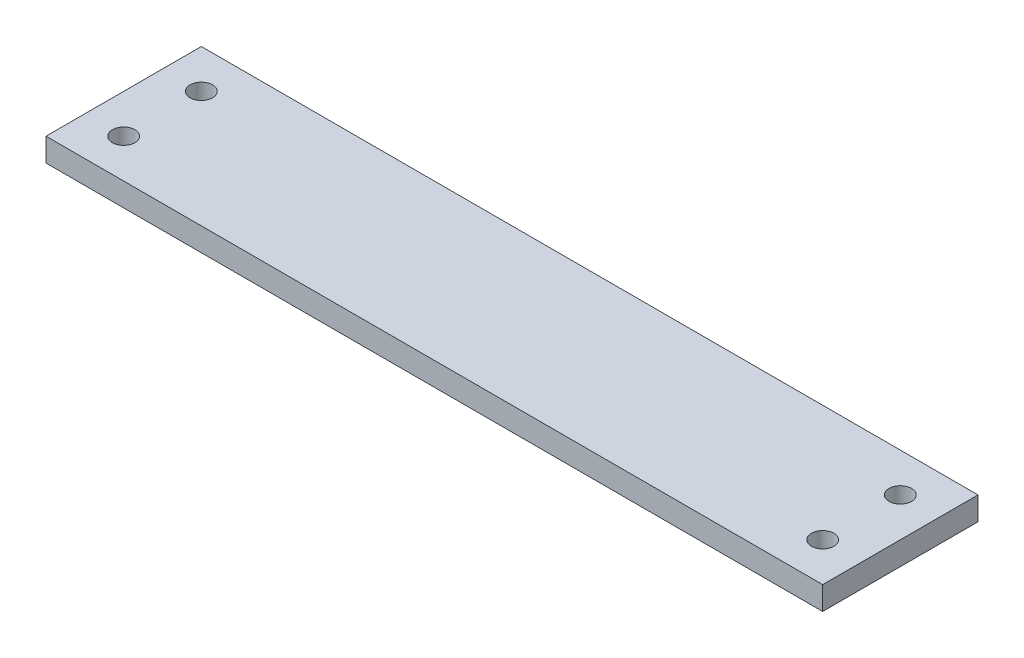
from build123d import *

# Parameters (mm, degrees)
SKETCH_1_W          = 100
SKETCH_1_H          = 20
EXTRUDE_1_DEPTH     = 3
SKETCH_2_R          = 1.45
CUT_EXTRUDE_1_DEPTH = 6


with BuildPart() as part:
    # 草图1 → 凸台-拉伸1 (new body)
    with BuildSketch(Plane(origin=(0, 0, 0), x_dir=(1, 0, 0), z_dir=(0, 1, 0))):
        with Locations((-50, 10)):
            Rectangle(SKETCH_1_W, SKETCH_1_H)
    extrude(amount=EXTRUDE_1_DEPTH)

    # 草图2 → 切除-拉伸1 (cut)
    with BuildSketch(Plane(origin=(0, 3, 0), x_dir=(1, 0, 0), z_dir=(0, 1, 0))):
        with Locations(Location((-95, 15, 0), (0, 0, 270))):
            Circle(SKETCH_2_R)
        with Locations(Location((-95, 5, 0), (0, 0, 270))):
            Circle(SKETCH_2_R)
        with Locations(Location((-5, 5, 0), (0, 0, 270))):
            Circle(SKETCH_2_R)
        with Locations(Location((-5, 15, 0), (0, 0, 270))):
            Circle(SKETCH_2_R)
    extrude(amount=-CUT_EXTRUDE_1_DEPTH, mode=Mode.SUBTRACT)


solid = part.part
